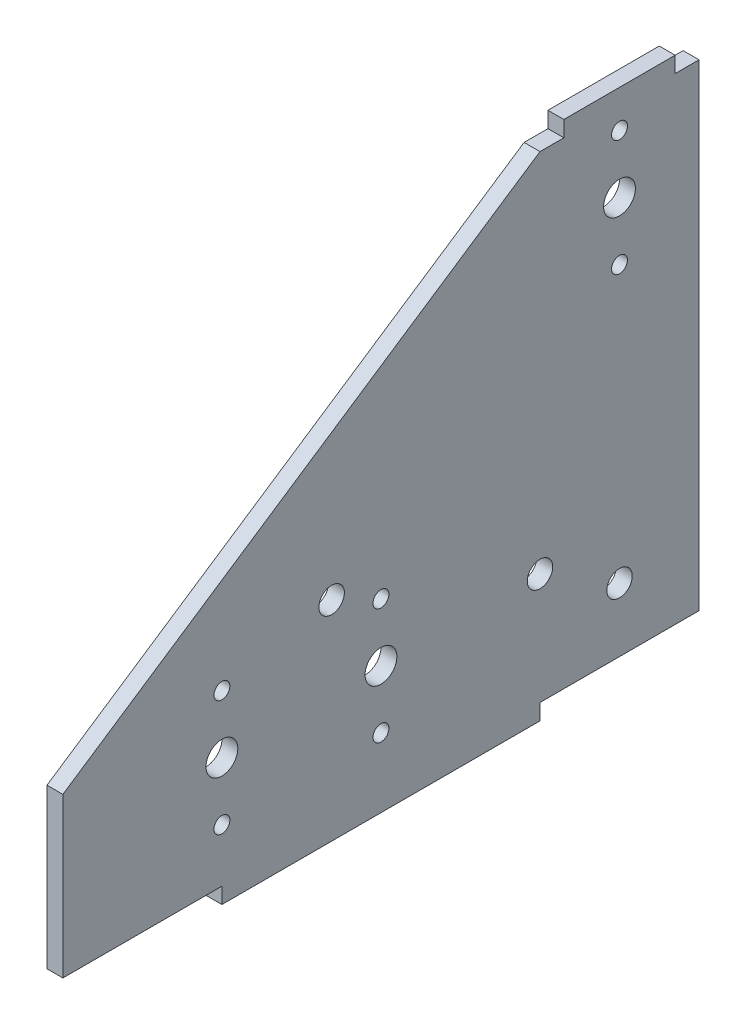
from build123d import *

# Parameters (mm, degrees)
CROQUIS1_R              = 5
CROQUIS1_R_2            = 4
CROQUIS1_R_3            = 2.5
SALIENTE_EXTRUIR1_DEPTH = 5


with BuildPart() as part:
    # Croquis1 → Saliente-Extruir1 (new body)
    with BuildSketch(Plane(origin=(0, 0, 0), x_dir=(0, 0, -1), z_dir=(1, 0, 0))):
        Polygon((150, 150), (0, 50), (0, 0), (50, 0), (50, -5), (150, -5), (150, 0), (200, 0), (200, 150), (192.5, 150), (192.5, 155), (157.5, 155), (157.5, 150), align=None)
        with Locations((175, 125)):
            Circle(CROQUIS1_R, mode=Mode.SUBTRACT)
        with Locations((175, 20)):
            Circle(CROQUIS1_R_2, mode=Mode.SUBTRACT)
        with Locations((150, 35)):
            Circle(CROQUIS1_R_2, mode=Mode.SUBTRACT)
        with Locations((175, 143.25)):
            Circle(CROQUIS1_R_3, mode=Mode.SUBTRACT)
        with Locations((175, 106.75)):
            Circle(CROQUIS1_R_3, mode=Mode.SUBTRACT)
        with Locations((100, 35)):
            Circle(CROQUIS1_R, mode=Mode.SUBTRACT)
        with Locations((84.5, 60.685599078)):
            Circle(CROQUIS1_R_2, mode=Mode.SUBTRACT)
        with Locations((100, 53.25)):
            Circle(CROQUIS1_R_3, mode=Mode.SUBTRACT)
        with Locations((100, 16.75)):
            Circle(CROQUIS1_R_3, mode=Mode.SUBTRACT)
        with Locations((50, 35)):
            Circle(CROQUIS1_R, mode=Mode.SUBTRACT)
        with Locations((50, 53.25)):
            Circle(CROQUIS1_R_3, mode=Mode.SUBTRACT)
        with Locations((50, 16.75)):
            Circle(CROQUIS1_R_3, mode=Mode.SUBTRACT)
    extrude(amount=SALIENTE_EXTRUIR1_DEPTH)


solid = part.part
